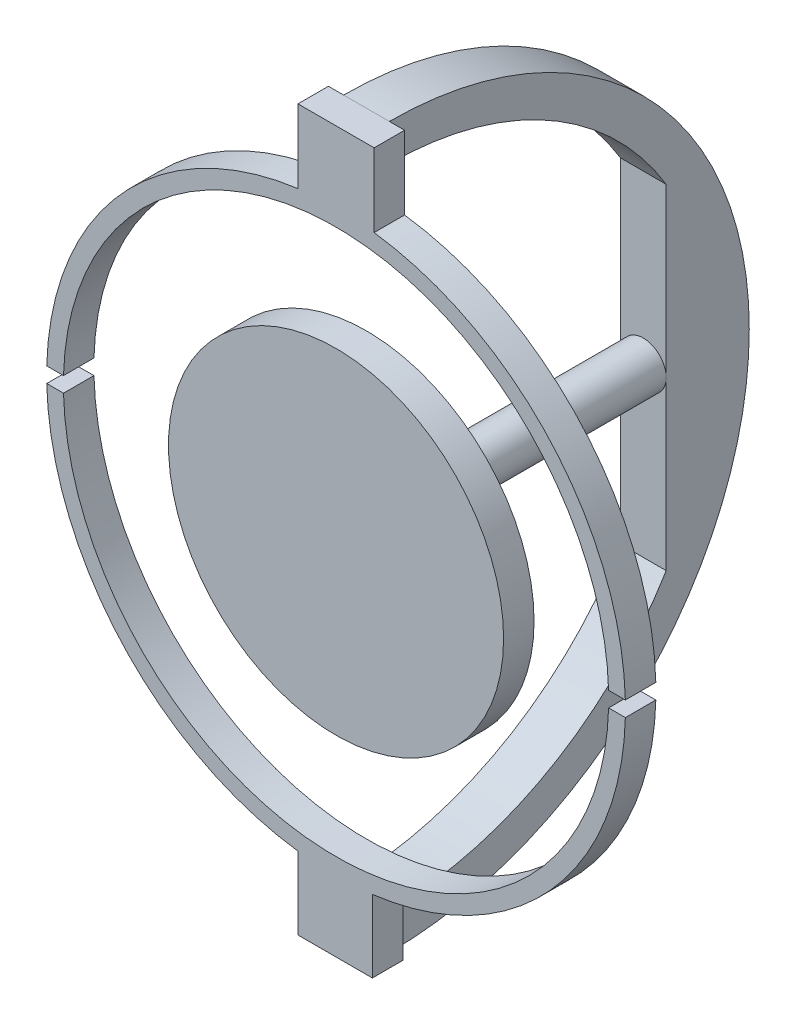
from build123d import *

# Parameters (mm, degrees)
BOSS_EXTRUDE10_DEPTH = 2
BOSS_EXTRUDE11_DEPTH = 1.5
SKETCH8_R            = 1.5
BOSS_EXTRUDE12_DEPTH = 21


with BuildPart() as part:
    # Sketch1 → Boss-Extrude10 (new body)
    with BuildSketch(Plane.XY):
        with BuildLine():
            ThreePointArc((2.5, 18.834808202), (0, 19), (-2.5, 18.834808202))
            Line((-2.5, 18.834808202), (-2.5, 18.653696235))
            Line((-2.5, 18.653696235), (2.5, 18.653696235))
            Line((2.5, 18.653696235), (2.5, 18.834808202))
        make_face()
        with BuildLine():
            Line((-2.5, 23.653696235), (-2.5, 18.834808202))
            ThreePointArc((-2.5, 18.834808202), (0, 19), (2.5, 18.834808202))
            Line((2.5, 18.834808202), (2.5, 23.653696235))
            Line((2.5, 23.653696235), (-2.5, 23.653696235))
        make_face()
        with BuildLine():
            ThreePointArc((-2.5, 18.834808202), (-14.123191749, 12.709659901), (-18.993227641, 0.507251182))
            Line((-18.993227641, 0.507251182), (-17.892811301, 0.507251182))
            ThreePointArc((-17.892811301, 0.507251182), (0, 17.9), (17.892811301, 0.507251182))
            Line((17.892811301, 0.507251182), (18.993227641, 0.507251182))
            ThreePointArc((18.993227641, 0.507251182), (14.123191749, 12.709659901), (2.5, 18.834808202))
            Line((2.5, 18.834808202), (2.5, 18.653696235))
            Line((2.5, 18.653696235), (-2.5, 18.653696235))
            Line((-2.5, 18.653696235), (-2.5, 18.834808202))
        make_face()
        with BuildLine():
            Line((-17.893216553, -0.492748818), (-18.993609415, -0.492748818))
            ThreePointArc((-18.993609415, -0.492748818), (-14.12804293, -12.704267117), (-2.5, -18.834808202))
            Line((-2.5, -18.834808202), (-2.5, -18.60362099))
            Line((-2.5, -18.60362099), (2.384110391, -18.60362099))
            Line((2.384110391, -18.60362099), (2.384110391, -18.849828053))
            ThreePointArc((2.384110391, -18.849828053), (14.088907535, -12.747654077), (18.993609415, -0.492748818))
            Line((18.993609415, -0.492748818), (17.893216553, -0.492748818))
            ThreePointArc((17.893216553, -0.492748818), (0, -17.9), (-17.893216553, -0.492748818))
        make_face()
        with BuildLine():
            Line((10.988958031, -0.492748818), (-10.988958031, -0.492748818))
            ThreePointArc((-10.988958031, -0.492748818), (0, -11), (10.988958031, -0.492748818))
        make_face()
        with BuildLine():
            Line((10.98829815, 0.507251182), (-10.98829815, 0.507251182))
            ThreePointArc((-10.98829815, 0.507251182), (-10.999997605, 0.007258684), (-10.988958031, -0.492748818))
            Line((-10.988958031, -0.492748818), (10.988958031, -0.492748818))
            ThreePointArc((10.988958031, -0.492748818), (10.997239161, -0.246436261), (11, 0))
            ThreePointArc((11, 0), (10.997074148, 0.25369307), (10.98829815, 0.507251182))
        make_face()
        with BuildLine():
            ThreePointArc((10.98829815, 0.507251182), (0, 11), (-10.98829815, 0.507251182))
            Line((-10.98829815, 0.507251182), (10.98829815, 0.507251182))
        make_face()
        with BuildLine():
            ThreePointArc((2.384110391, -18.849828053), (-0.058429439, -18.999910158), (-2.5, -18.834808202))
            Line((-2.5, -18.834808202), (-2.5, -23.60362099))
            Line((-2.5, -23.60362099), (2.384110391, -23.60362099))
            Line((2.384110391, -23.60362099), (2.384110391, -18.849828053))
        make_face()
        with BuildLine():
            Line((-2.5, -18.60362099), (-2.5, -18.834808202))
            ThreePointArc((-2.5, -18.834808202), (-0.058429439, -18.999910158), (2.384110391, -18.849828053))
            Line((2.384110391, -18.849828053), (2.384110391, -18.60362099))
            Line((2.384110391, -18.60362099), (-2.5, -18.60362099))
        make_face()
    extrude(amount=BOSS_EXTRUDE10_DEPTH)

    # Sketch7 → Boss-Extrude11 (add, symmetric)
    with BuildSketch(Plane(origin=(0, 0, 0), x_dir=(0, 0, -1), z_dir=(1, 0, 0))):
        with BuildLine():
            ThreePointArc((0, 21.244252218), (21.23548837, 0.008763848), (0, -21.226724522))
            Line((0, -21.226724522), (0, -23.60362099))
            ThreePointArc((0, -23.60362099), (23.628658612, 0.025037622), (0, 23.653696235))
            Line((0, 23.653696235), (0, 21.244252218))
        make_face()
        with BuildLine():
            ThreePointArc((18.174866248, -10.973959092), (21.23548837, 0.008763848), (18.174866248, 10.991486788))
            Line((18.174866248, 10.991486788), (18.174866248, -10.973959092))
        make_face()
    extrude(amount=BOSS_EXTRUDE11_DEPTH, both=True)

    # Sketch8 → Boss-Extrude12 (add)
    with BuildSketch(Plane.XY):
        Circle(SKETCH8_R)
    extrude(amount=-BOSS_EXTRUDE12_DEPTH)


solid = part.part
